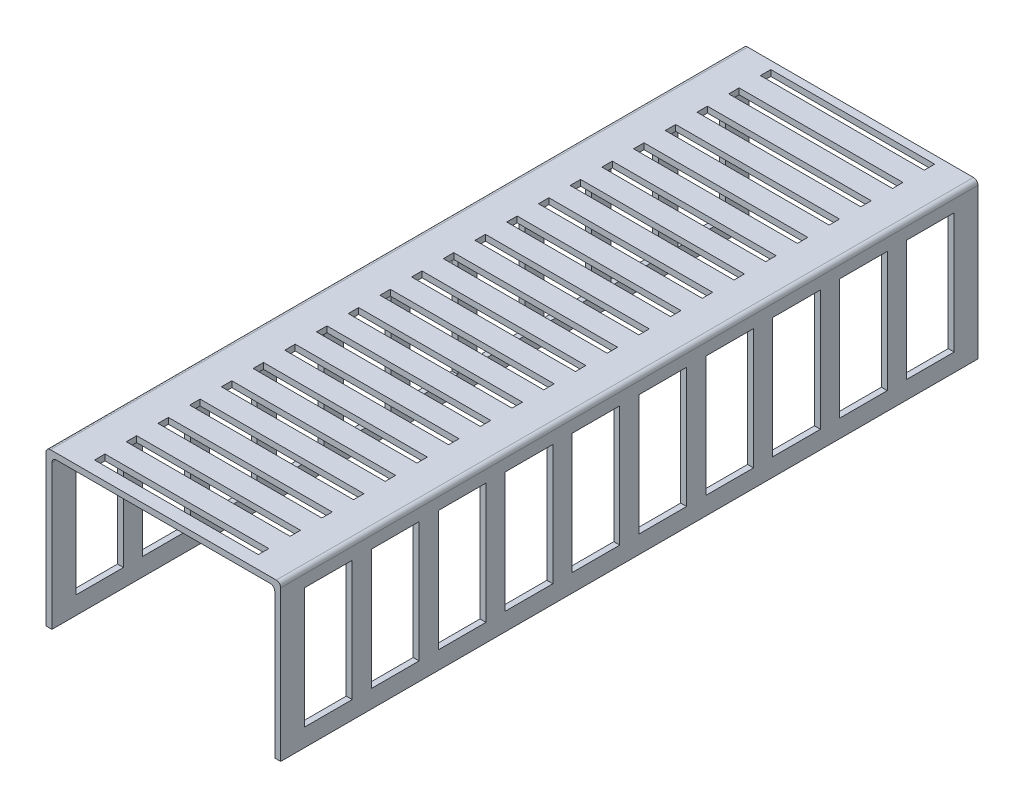
from build123d import *

# Parameters (mm, degrees)
SKETCH2_W           = 78.8
SKETCH2_H           = 234.1
SKETCH2_W_2         = 55
SKETCH2_H_2         = 3.5
BOSS_EXTRUDE1_DEPTH = 2
SKETCH3_W           = 2
SKETCH3_H           = 234.1
BOSS_EXTRUDE2_DEPTH = 50
FILLET1_R           = 1.5
SKETCH4_W           = 16
SKETCH4_H           = 40.5
CUT_EXTRUDE1_DEPTH  = 26478.505859123


with BuildPart() as part:
    # Sketch2 → Boss-Extrude1 (new body)
    with BuildSketch(Plane(origin=(0, 26475.049263039, 0), x_dir=(1, 0, 0), z_dir=(0, 1, 0))):
        with Locations((-7.2, 17)):
            Rectangle(SKETCH2_W, SKETCH2_H)
        with Locations((-7.2, 119.004761905)):
            Rectangle(SKETCH2_W_2, SKETCH2_H_2, mode=Mode.SUBTRACT)
        with Locations((-7.2, 129.65)):
            Rectangle(SKETCH2_W_2, SKETCH2_H_2, mode=Mode.SUBTRACT)
        with Locations((-7.2, 108.35952381)):
            Rectangle(SKETCH2_W_2, SKETCH2_H_2, mode=Mode.SUBTRACT)
        with Locations((-7.2, 97.714285714)):
            Rectangle(SKETCH2_W_2, SKETCH2_H_2, mode=Mode.SUBTRACT)
        with Locations((-7.2, 87.069047619)):
            Rectangle(SKETCH2_W_2, SKETCH2_H_2, mode=Mode.SUBTRACT)
        with Locations((-7.2, 76.423809524)):
            Rectangle(SKETCH2_W_2, SKETCH2_H_2, mode=Mode.SUBTRACT)
        with Locations((-7.2, 65.778571429)):
            Rectangle(SKETCH2_W_2, SKETCH2_H_2, mode=Mode.SUBTRACT)
        with Locations((-7.2, 55.133333333)):
            Rectangle(SKETCH2_W_2, SKETCH2_H_2, mode=Mode.SUBTRACT)
        with Locations((-7.2, 44.488095238)):
            Rectangle(SKETCH2_W_2, SKETCH2_H_2, mode=Mode.SUBTRACT)
        with Locations((-7.2, 33.842857143)):
            Rectangle(SKETCH2_W_2, SKETCH2_H_2, mode=Mode.SUBTRACT)
        with Locations((-7.2, 23.197619048)):
            Rectangle(SKETCH2_W_2, SKETCH2_H_2, mode=Mode.SUBTRACT)
        with Locations((-7.2, 12.552380952)):
            Rectangle(SKETCH2_W_2, SKETCH2_H_2, mode=Mode.SUBTRACT)
        with Locations((-7.2, 1.907142857)):
            Rectangle(SKETCH2_W_2, SKETCH2_H_2, mode=Mode.SUBTRACT)
        with Locations((-7.2, -8.738095238)):
            Rectangle(SKETCH2_W_2, SKETCH2_H_2, mode=Mode.SUBTRACT)
        with Locations((-7.2, -19.383333333)):
            Rectangle(SKETCH2_W_2, SKETCH2_H_2, mode=Mode.SUBTRACT)
        with Locations((-7.2, -30.028571429)):
            Rectangle(SKETCH2_W_2, SKETCH2_H_2, mode=Mode.SUBTRACT)
        with Locations((-7.2, -40.673809524)):
            Rectangle(SKETCH2_W_2, SKETCH2_H_2, mode=Mode.SUBTRACT)
        with Locations((-7.2, -51.319047619)):
            Rectangle(SKETCH2_W_2, SKETCH2_H_2, mode=Mode.SUBTRACT)
        with Locations((-7.2, -61.964285714)):
            Rectangle(SKETCH2_W_2, SKETCH2_H_2, mode=Mode.SUBTRACT)
        with Locations((-7.2, -72.60952381)):
            Rectangle(SKETCH2_W_2, SKETCH2_H_2, mode=Mode.SUBTRACT)
        with Locations((-7.2, -83.254761905)):
            Rectangle(SKETCH2_W_2, SKETCH2_H_2, mode=Mode.SUBTRACT)
        with Locations((-7.2, -93.9)):
            Rectangle(SKETCH2_W_2, SKETCH2_H_2, mode=Mode.SUBTRACT)
    extrude(amount=BOSS_EXTRUDE1_DEPTH)

    # Sketch3 → Boss-Extrude2 (add)
    with BuildSketch(Plane.XZ.offset(-26475.049263039)):
        with Locations((-45.6, -17)):
            Rectangle(SKETCH3_W, SKETCH3_H)
        with Locations((31.2, -17)):
            Rectangle(SKETCH3_W, SKETCH3_H)
    extrude(amount=BOSS_EXTRUDE2_DEPTH)

    # Fillet1
    fillet1_edges = [part.edges().sort_by_distance(p)[0] for p in [
        (32.2, 26477.049263039, -17),
        (-44.6, 26475.049263039, -17),
        (30.2, 26475.049263039, -17),
        (-46.6, 26477.049263039, -17),
    ]]
    fillet(fillet1_edges, radius=FILLET1_R)

    # Sketch4 → Cut-Extrude1 (cut, through all)
    with BuildSketch(Plane(origin=(32.2, 0, 0), x_dir=(0, 0, -1), z_dir=(1, 0, 0))):
        with Locations((-84.05, 26451.299263039)):
            Rectangle(SKETCH4_W, SKETCH4_H)
        with Locations((-61.594444444, 26451.299263039)):
            Rectangle(SKETCH4_W, SKETCH4_H)
        with Locations((-39.138888889, 26451.299263039)):
            Rectangle(SKETCH4_W, SKETCH4_H)
        with Locations((-16.683333333, 26451.299263039)):
            Rectangle(SKETCH4_W, SKETCH4_H)
        with Locations((5.772222222, 26451.299263039)):
            Rectangle(SKETCH4_W, SKETCH4_H)
        with Locations((28.227777778, 26451.299263039)):
            Rectangle(SKETCH4_W, SKETCH4_H)
        with Locations((50.683333333, 26451.299263039)):
            Rectangle(SKETCH4_W, SKETCH4_H)
        with Locations((73.138888889, 26451.299263039)):
            Rectangle(SKETCH4_W, SKETCH4_H)
        with Locations((95.594444444, 26451.299263039)):
            Rectangle(SKETCH4_W, SKETCH4_H)
        with Locations((118.05, 26451.299263039)):
            Rectangle(SKETCH4_W, SKETCH4_H)
    extrude(amount=-CUT_EXTRUDE1_DEPTH, mode=Mode.SUBTRACT)


solid = part.part
